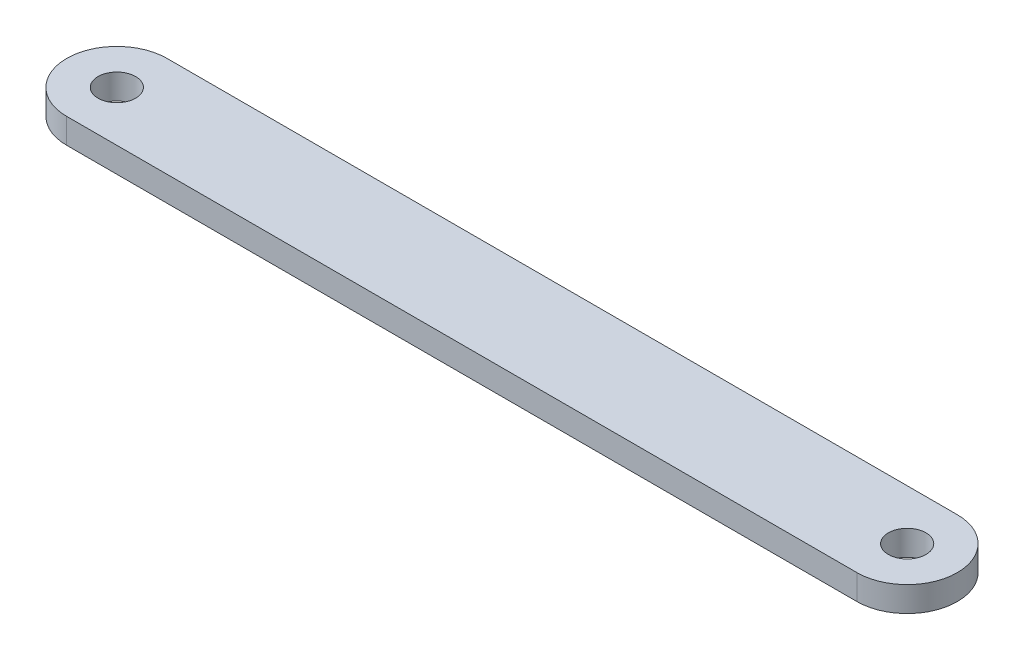
from build123d import *

# Parameters (mm, degrees)
ESQUISSE1_R        = 1.5
BOSS_EXTRU_1_DEPTH = 2


with BuildPart() as part:
    # Esquisse1 → Boss.-Extru.1 (new body)
    with BuildSketch(Plane(origin=(0, 0, 0), x_dir=(1, 0, 0), z_dir=(0, 1, 0))):
        with BuildLine():
            Line((0, 4), (63, 4))
            ThreePointArc((63, 4), (67, 0), (63, -4))
            Line((63, -4), (0, -4))
            ThreePointArc((0, -4), (-4, 0), (0, 4))
        make_face()
        with Locations(Location((0, 0, 0), (0, 0, 270))):
            Circle(ESQUISSE1_R, mode=Mode.SUBTRACT)
        with Locations(Location((63, 0, 0), (0, 0, 270))):
            Circle(ESQUISSE1_R, mode=Mode.SUBTRACT)
    extrude(amount=BOSS_EXTRU_1_DEPTH)


solid = part.part
